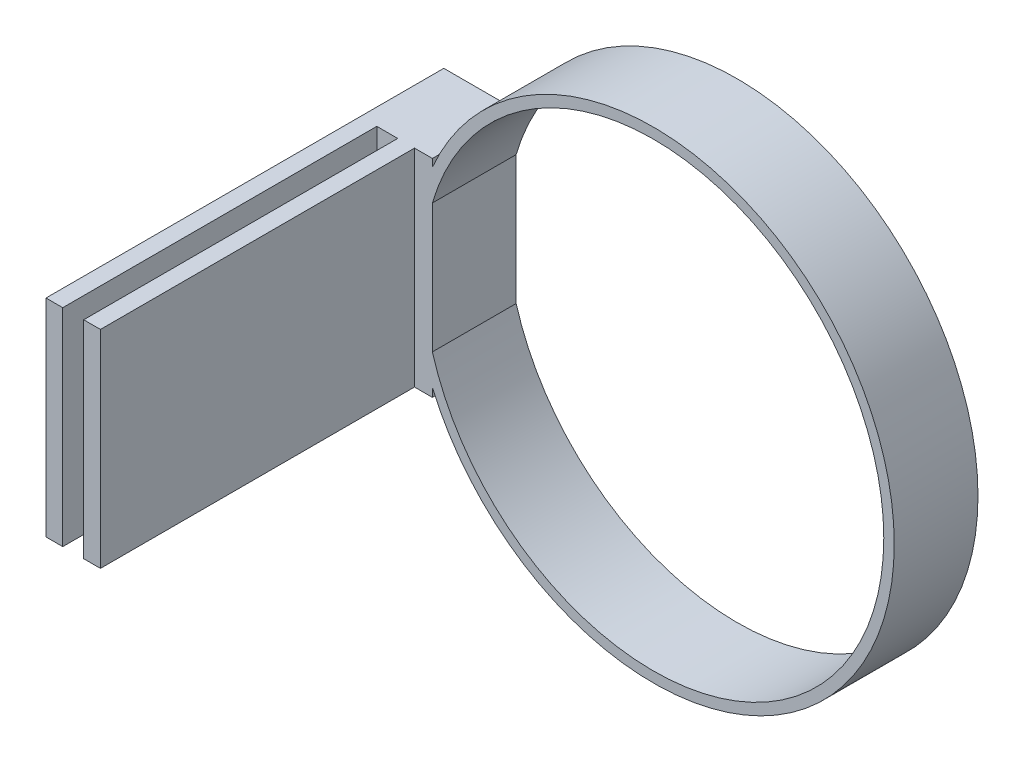
from build123d import *

# Parameters (mm, degrees)
SKETCH_1_R      = 57.5
SKETCH_1_R_2    = 55
SKETCH_1_W      = 17.269051877
SKETCH_1_H      = 49.42521744
EXTRUDE_1_DEPTH = 20
SKETCH_2_W      = 4
SKETCH_2_H      = 49.42521744
EXTRUDE_2_DEPTH = 75


with BuildPart() as part:
    # 草圖1 → 填料-伸長1 (new body)
    # profile 1 of 2: a face of its own
    with BuildSketch(Plane.XY):
        with Locations((36.644946032, -4.863123804)):
            Circle(SKETCH_1_R)
        with Locations((36.644946032, -4.863123804)):
            Circle(SKETCH_1_R_2, mode=Mode.SUBTRACT)
    # profile 2 of 2: a face of its own
    with BuildSketch(Plane.XY):
        with Locations((-24.789209782, -4.962371229)):
            Rectangle(SKETCH_1_W, SKETCH_1_H)
    extrude(amount=EXTRUDE_1_DEPTH)

    # 草圖2 → 填料-伸長2 (add)
    with BuildSketch(Plane.XY.offset(20)):
        with Locations((-31.42373572, -4.962371229)):
            Rectangle(SKETCH_2_W, SKETCH_2_H)
        with Locations((-22.42373572, -4.962371229)):
            Rectangle(SKETCH_2_W, SKETCH_2_H)
    extrude(amount=EXTRUDE_2_DEPTH)


solid = part.part
